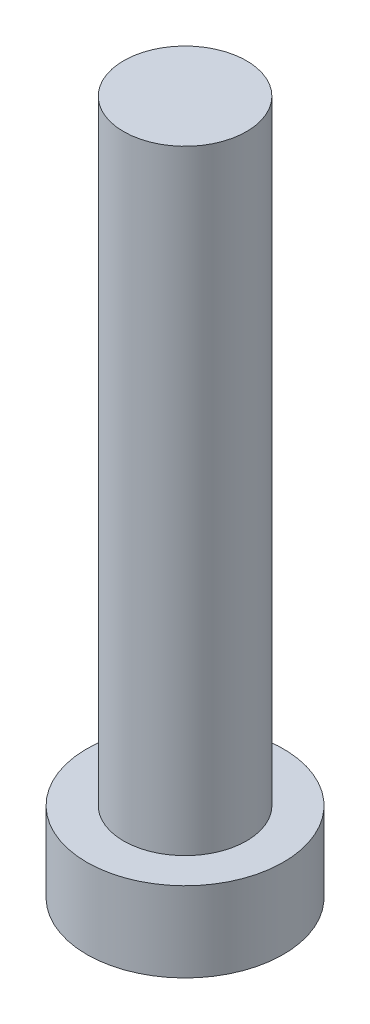
from build123d import *

# Parameters (mm, degrees)
SKETCH_1_R      = 1.6
EXTRUDE_1_DEPTH = 1.3
EXTRUDE_START   = 1.3
SKETCH_2_R      = 1
EXTRUDE_2_DEPTH = 10


with BuildPart() as part:
    # 草图1 → 凸台-拉伸1 (new body)
    with BuildSketch(Plane(origin=(0, 0, 0), x_dir=(1, 0, 0), z_dir=(0, 1, 0))):
        with Locations(Location((0, 0, 0), (0, 0, 270))):
            Circle(SKETCH_1_R)
    extrude(amount=EXTRUDE_1_DEPTH)

    # 草图2 → 凸台-拉伸2 (add)
    with BuildSketch(Plane(origin=(0, 0, 0), x_dir=(1, 0, 0), z_dir=(0, 1, 0)).offset(EXTRUDE_START)):
        with Locations(Location((0, 0, 0), (0, 0, 270))):
            Circle(SKETCH_2_R)
    extrude(amount=EXTRUDE_2_DEPTH)


solid = part.part
